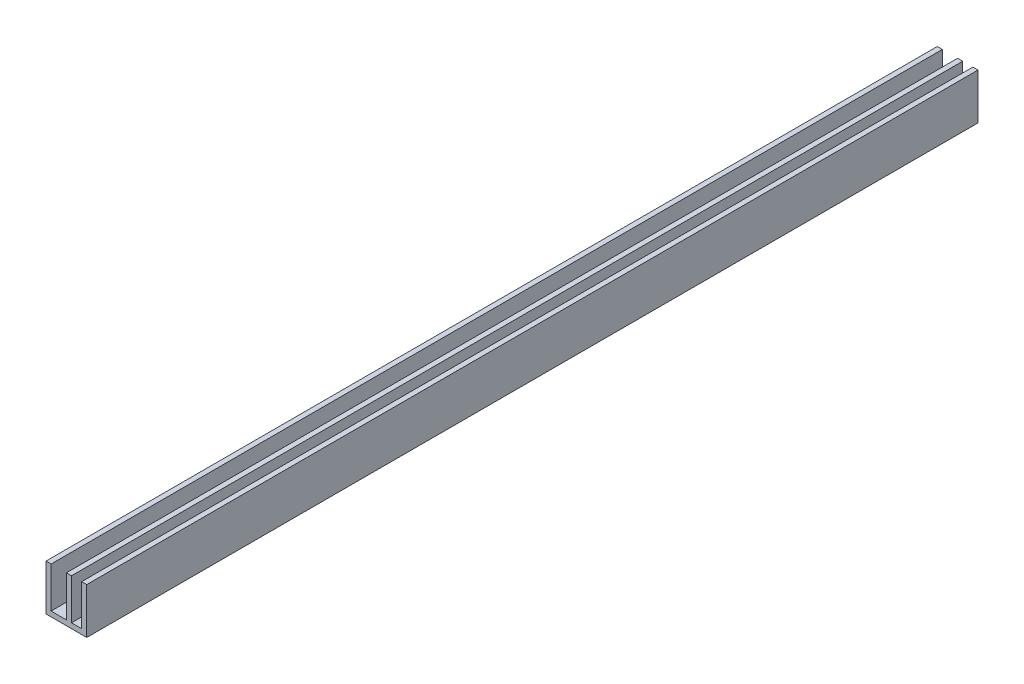
from build123d import *

# Parameters (mm, degrees)
SALIENTE_EXTRUIR1_DEPTH = 17500
CROQUIS2_W              = 100
CROQUIS2_H              = 300
SALIENTE_EXTRUIR2_DEPTH = 17500


with BuildPart() as part:
    # Croquis1 → Saliente-Extruir1 (new body)
    with BuildSketch(Plane.XY):
        Polygon((0, 0), (-800, 0), (-800, 600), (-700, 600), (-700, 100), (-400, 100), (-400, 470), (-300, 470), (-300, 100), (-100, 100), (-100, 600), (0, 600), align=None)
    extrude(amount=SALIENTE_EXTRUIR1_DEPTH)

    # Croquis2 → Saliente-Extruir2 (add)
    with BuildSketch(Plane(origin=(0, 0, 0), x_dir=(-1, 0, 0), z_dir=(0, 0, -1))):
        with Locations((50, 750)):
            Rectangle(CROQUIS2_W, CROQUIS2_H)
        with Locations((750, 750)):
            Rectangle(CROQUIS2_W, CROQUIS2_H)
        Polygon((400, 600), (400, 470), (300, 470), (300, 900), (400, 900), align=None)
    extrude(amount=-SALIENTE_EXTRUIR2_DEPTH)


solid = part.part
